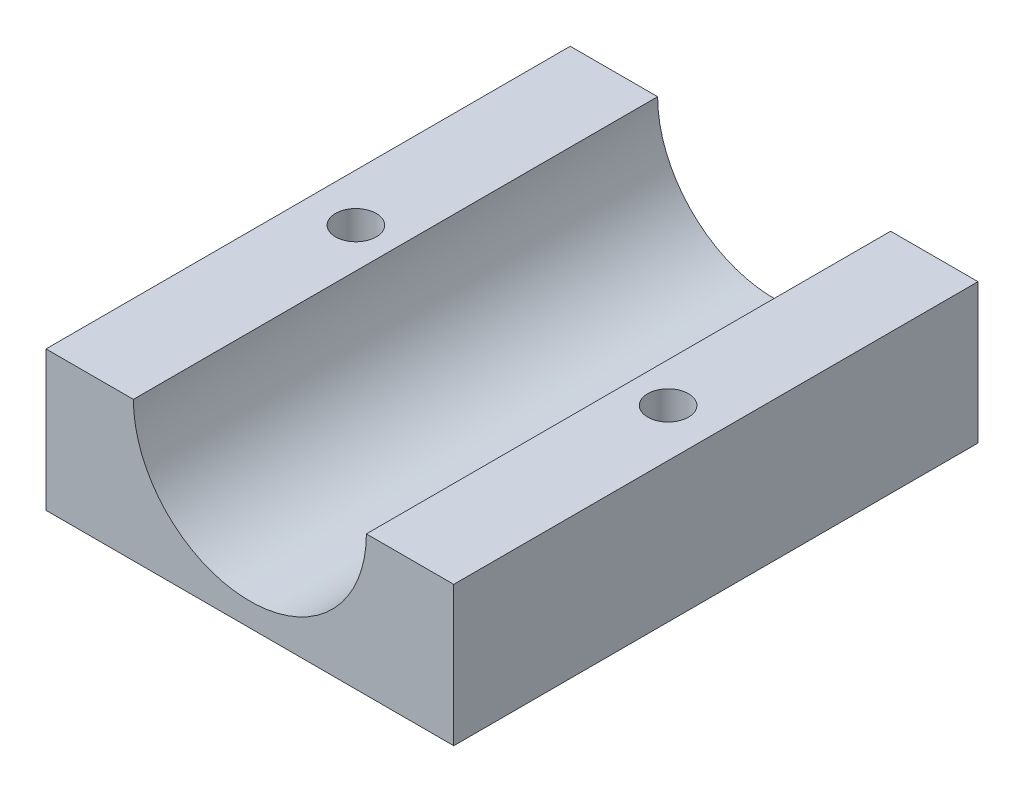
from build123d import *

# Parameters (mm, degrees)
SKETCH1_W           = 35
SKETCH1_H           = 45
BOSS_EXTRUDE1_DEPTH = 12
SKETCH2_R           = 10
CUT_EXTRUDE1_DEPTH  = 59.258046655
SKETCH3_R           = 1.75
CUT_EXTRUDE2_DEPTH  = 25


with BuildPart() as part:
    # Sketch1 → Boss-Extrude1 (new body)
    with BuildSketch(Plane(origin=(0, 0, 0), x_dir=(1, 0, 0), z_dir=(0, 1, 0))):
        with Locations((17.5, 22.5)):
            Rectangle(SKETCH1_W, SKETCH1_H)
    extrude(amount=BOSS_EXTRUDE1_DEPTH)

    # Sketch2 → Cut-Extrude1 (cut, through all)
    with BuildSketch(Plane.XY):
        with Locations((17.5, 12)):
            Circle(SKETCH2_R)
    extrude(amount=-CUT_EXTRUDE1_DEPTH, mode=Mode.SUBTRACT)

    # Sketch3 → Cut-Extrude2 (cut)
    with BuildSketch(Plane(origin=(0, 12, 0), x_dir=(1, 0, 0), z_dir=(0, 1, 0))):
        with Locations(Location((30.9, 22.5, 0), (0, 0, 270))):
            Circle(SKETCH3_R)
        with Locations(Location((4.1, 22.5, 0), (0, 0, 270))):
            Circle(SKETCH3_R)
    extrude(amount=-CUT_EXTRUDE2_DEPTH, mode=Mode.SUBTRACT)


solid = part.part
